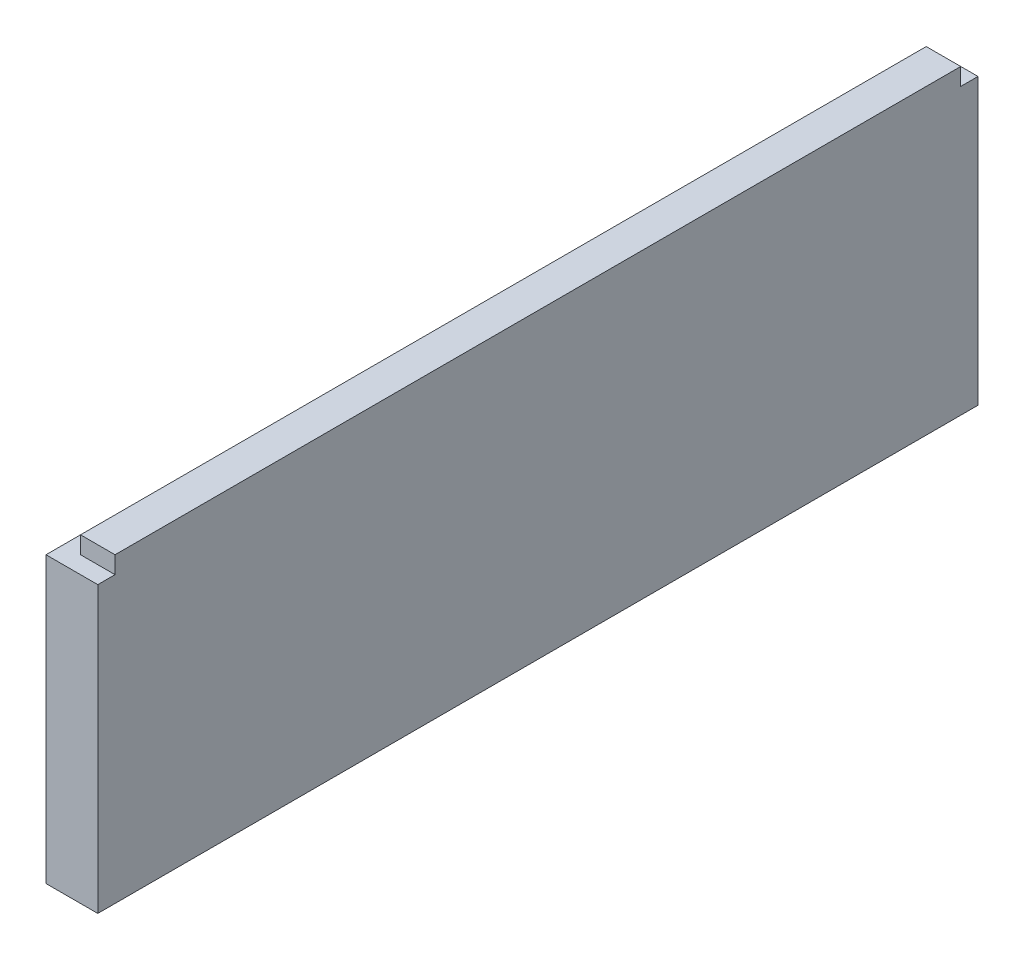
from build123d import *

# Parameters (mm, degrees)
EXTRUDE_1_DEPTH     = 510
SKETCH_2_W          = 10
SKETCH_2_H          = 10
CUT_EXTRUDE_1_DEPTH = 541.023147652


with BuildPart() as part:
    # Эскиз1 → Бобышка-Вытянуть1 (new body)
    with BuildSketch(Plane.XY):
        Polygon((0, 0), (10, 0), (30, 0), (30, 175), (10, 175), (10, 165), (0, 165), align=None)
    extrude(amount=EXTRUDE_1_DEPTH)

    # Эскиз2 → Вырез-Вытянуть1 (cut, through all)
    with BuildSketch(Plane(origin=(30, 0, 0), x_dir=(0, 0, -1), z_dir=(1, 0, 0))):
        with Locations((-5, 170)):
            Rectangle(SKETCH_2_W, SKETCH_2_H)
        with Locations((-505, 170)):
            Rectangle(SKETCH_2_W, SKETCH_2_H)
    extrude(amount=-CUT_EXTRUDE_1_DEPTH, mode=Mode.SUBTRACT)


solid = part.part
